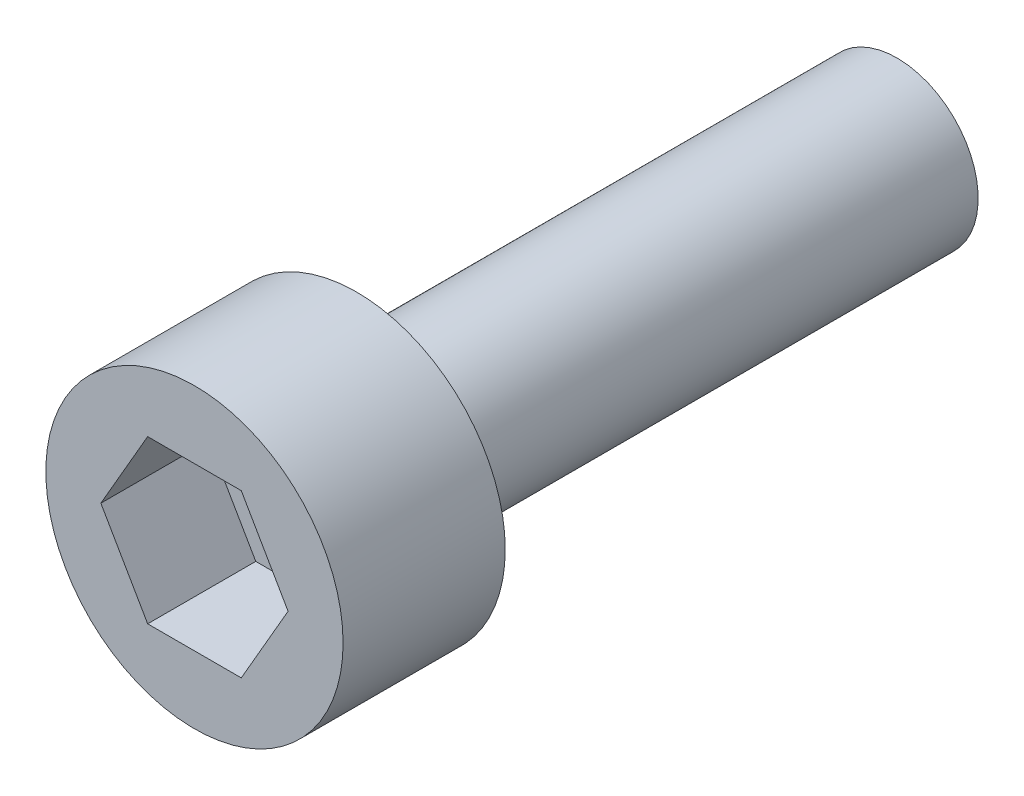
from build123d import *

# Parameters (mm, degrees)
SKETCH_1_R      = 2.75
EXTRUDE_1_DEPTH = 3
SKETCH_2_R      = 1.5
EXTRUDE_2_DEPTH = 10
EXTRUDE_3_DEPTH = 1


with BuildPart() as part:
    # 草图1 → 凸台-拉伸1 (new body)
    with BuildSketch(Plane.XY):
        Circle(SKETCH_1_R)
        Polygon((1.732050808, 0), (0.866025404, 1.5), (-0.866025404, 1.5), (-1.732050808, 0), (-0.866025404, -1.5), (0.866025404, -1.5), align=None, mode=Mode.SUBTRACT)
    extrude(amount=EXTRUDE_1_DEPTH)



with BuildPart() as body_2:
    # 草图2 → 凸台-拉伸2 (new body)
    with BuildSketch(Plane(origin=(0, 0, 0), x_dir=(-1, 0, 0), z_dir=(0, 0, -1))):
        Circle(SKETCH_2_R)
    extrude(amount=EXTRUDE_2_DEPTH)


with BuildPart() as part_1:
    add(part.part)

    add(body_2.part)  # 凸台-拉伸3 merges body 2
    # 草图1<3> → 凸台-拉伸3 (add)
    with BuildSketch(Plane.XY):
        Polygon((-0.866025404, -1.5), (0.866025404, -1.5), (1.732050808, 0), (0.866025404, 1.5), (-0.866025404, 1.5), (-1.732050808, 0), align=None)
    extrude(amount=EXTRUDE_3_DEPTH)


solid = part_1.part
